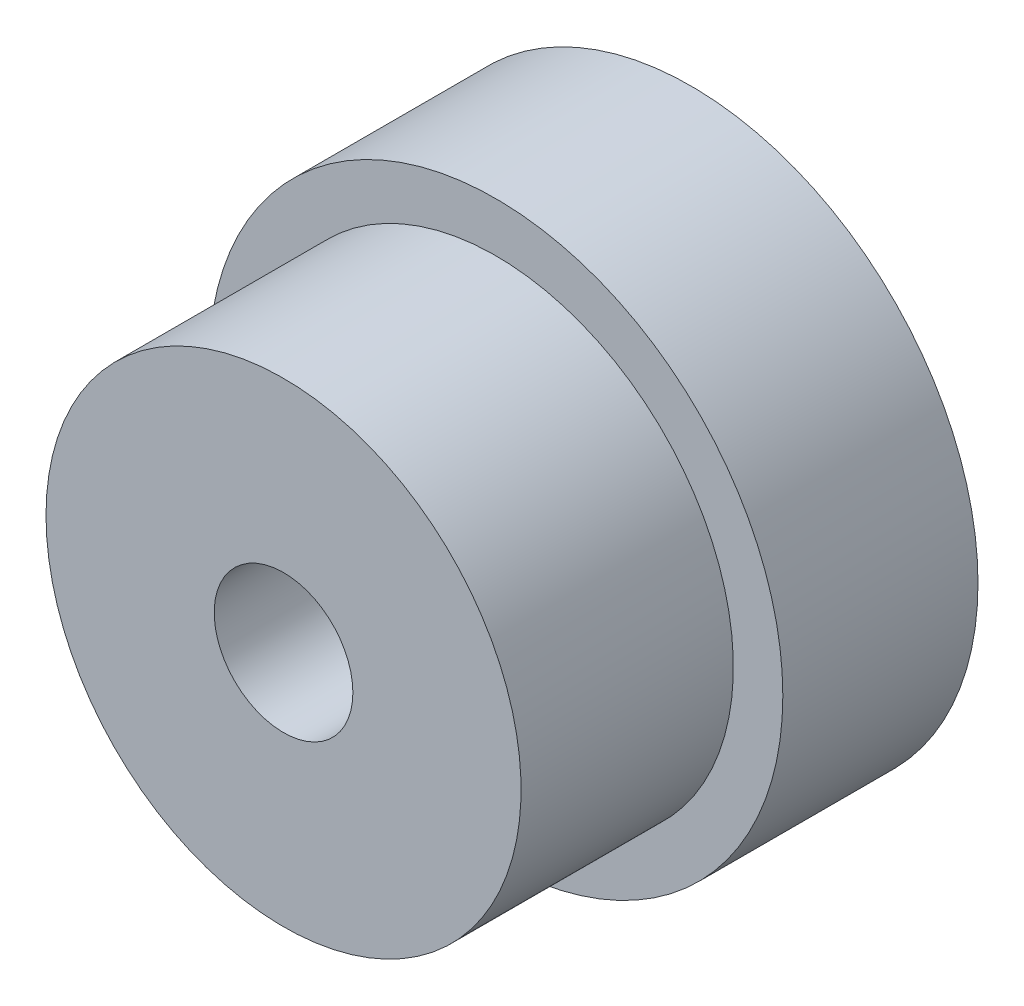
from build123d import *

# Parameters (mm, degrees)
CROQUIS1_R              = 16.765
SALIENTE_EXTRUIR1_DEPTH = 11.4
CROQUIS2_R              = 13.875
SALIENTE_EXTRUIR2_DEPTH = 12.4
CROQUIS3_R              = 4.05
CORTAR_EXTRUIR1_DEPTH   = 32.4


with BuildPart() as part:
    # Croquis1 → Saliente-Extruir1 (new body)
    with BuildSketch(Plane.XY):
        Circle(CROQUIS1_R)
    extrude(amount=SALIENTE_EXTRUIR1_DEPTH)

    # Croquis2 → Saliente-Extruir2 (add)
    with BuildSketch(Plane.XY.offset(11.4)):
        with Locations(Location((0, 0, 0), (0, 0, 180))):
            Circle(CROQUIS2_R)
    extrude(amount=SALIENTE_EXTRUIR2_DEPTH)

    # Croquis3 → Cortar-Extruir1 (cut)
    with BuildSketch(Plane.XY.offset(23.8)):
        Circle(CROQUIS3_R)
    extrude(amount=-CORTAR_EXTRUIR1_DEPTH, mode=Mode.SUBTRACT)


solid = part.part
